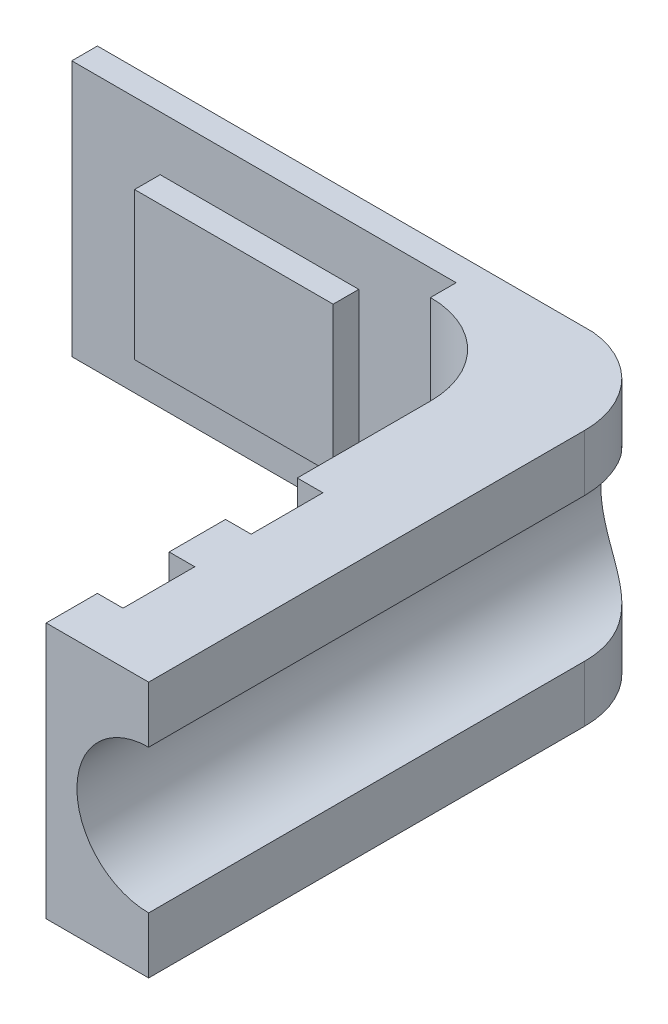
from build123d import *

# Parameters (mm, degrees)
BOSS_EXTRUDE1_DEPTH = 10
SKETCH2_W           = 7.75
SKETCH2_H           = 5.75
BOSS_EXTRUDE2_DEPTH = 1
CUT_EXTRUDE1_DEPTH  = 28.299267389
CUT_EXTRUDE2_START  = -2
CUT_EXTRUDE2_DEPTH  = 2.8
CUT_EXTRUDE3_START  = -7
CUT_EXTRUDE3_DEPTH  = 2.8


with BuildPart() as part:
    # Sketch1 → Boss-Extrude1 (new body)
    with BuildSketch(Plane(origin=(0, 0, 0), x_dir=(1, 0, 0), z_dir=(0, 1, 0))):
        with BuildLine():
            Line((-15, 4.5), (0, 4.5))
            Line((0, 4.5), (0, 3.5))
            ThreePointArc((0, 3.5), (2.474873734, 2.474873734), (3.5, 0))
            Line((3.5, 0), (3.5, -15))
            Line((3.5, -15), (7.5, -15))
            Line((7.5, -15), (7.5, 2.017195282))
            ThreePointArc((7.5, 2.017195282), (6.594493755, 4.366365807), (4.346513054, 5.5))
            Line((4.346513054, 5.5), (-15, 5.5))
            Line((-15, 5.5), (-15, 4.5))
        make_face()
    extrude(amount=BOSS_EXTRUDE1_DEPTH)

    # Sketch2 → Boss-Extrude2 (add)
    with BuildSketch(Plane.XY.offset(-4.5)):
        with Locations((-7.675, 5)):
            Rectangle(SKETCH2_W, SKETCH2_H)
    extrude(amount=BOSS_EXTRUDE2_DEPTH)

    # Sketch3 → Cut-Extrude1 (cut, through all)
    with BuildSketch(Plane.XY.offset(15)):
        with BuildLine():
            Line((7.5, 7.8), (7.5, 2.2))
            ThreePointArc((7.5, 2.2), (4.7, 5), (7.5, 7.8))
        make_face()
    extrude(amount=-CUT_EXTRUDE1_DEPTH, mode=Mode.SUBTRACT)

    # Sketch4 → Cut-Extrude2 (cut)
    with BuildSketch(Plane.XY.offset(15).offset(CUT_EXTRUDE2_START)):
        Polygon((4.5, 10), (3.5, 9), (3.5, 10), align=None)
        Polygon((3.5, 1), (3.5, 0), (4.5, 0), align=None)
    extrude(amount=-CUT_EXTRUDE2_DEPTH, mode=Mode.SUBTRACT)

    # Sketch4<2> → Cut-Extrude3 (cut)
    with BuildSketch(Plane.XY.offset(15).offset(CUT_EXTRUDE3_START)):
        Polygon((4.5, 10), (3.5, 9), (3.5, 10), align=None)
        Polygon((3.5, 1), (3.5, 0), (4.5, 0), align=None)
    extrude(amount=-CUT_EXTRUDE3_DEPTH, mode=Mode.SUBTRACT)


solid = part.part
